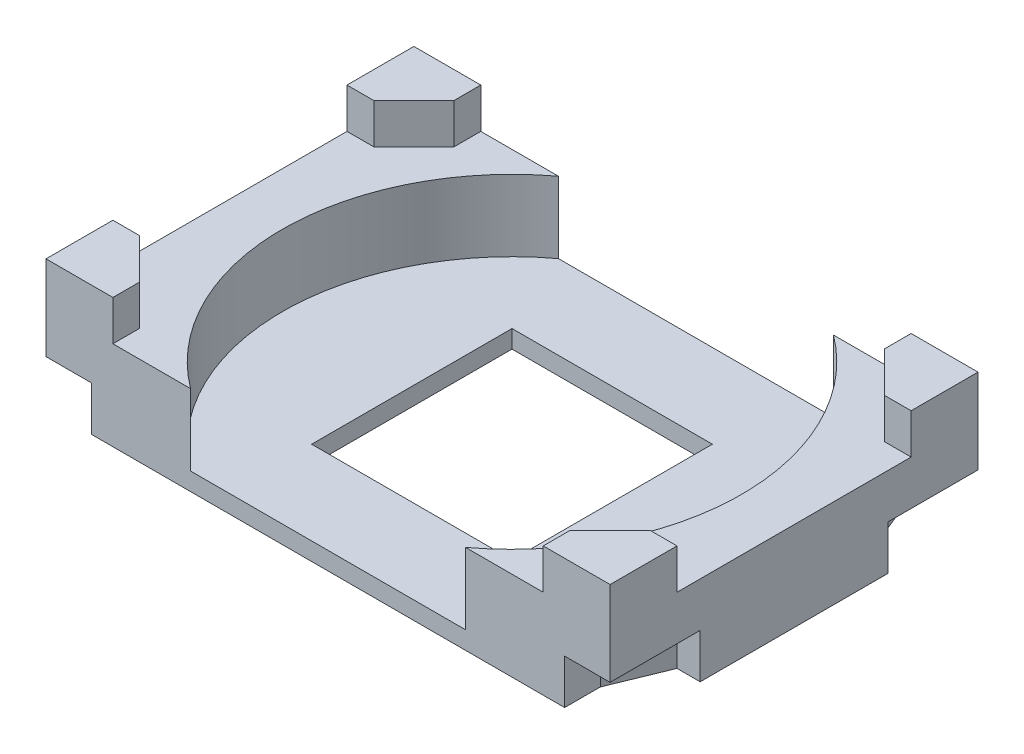
from build123d import *

# Parameters (mm, degrees)
SKETCH_1_W      = 44.92820323
SKETCH_1_H      = 44.928203231
EXTRUDE_1_DEPTH = 4
EXTRUDE_2_DEPTH = 6
EXTRUDE_3_DEPTH = 10
EXTRUDE_4_DEPTH = 9


with BuildPart() as part:
    # Эскиз1 → Бобышка-Вытянуть1 (new body)
    with BuildSketch(Plane(origin=(0, 102.195974268, 0), x_dir=(1, 0, 0), z_dir=(0, 1, 0))):
        Polygon((6.758980694, -68.473129836), (1.558980694, -68.473129836), (1.558980694, -110.573129836), (6.758980694, -110.573129836), (11.758980694, -122.773129836), (11.758980694, -130.773129836), (117.858980694, -130.773129836), (117.858980694, -122.773129836), (122.858980694, -110.573129836), (128.058980694, -110.573129836), (128.058980694, -68.473129836), (122.858980694, -68.473129836), (117.858980694, -56.273129836), (117.858980694, -48.273129836), (11.758980694, -48.273129836), (11.758980694, -56.273129836), align=None)
        with Locations((64.808980694, -89.523129837)):
            Rectangle(SKETCH_1_W, SKETCH_1_H, mode=Mode.SUBTRACT)
    extrude(amount=EXTRUDE_1_DEPTH)

    # Эскиз2 → Бобышка-Вытянуть2 (add)
    with BuildSketch(Plane(origin=(0, 106.195974268, 0), x_dir=(1, 0, 0), z_dir=(0, 1, 0))):
        with BuildLine():
            Line((95.642201414, -130.773129836), (117.858980694, -130.773129836))
            Line((117.858980694, -130.773129836), (117.858980694, -122.773129836))
            Line((117.858980694, -122.773129836), (122.858980694, -110.573129836))
            Line((122.858980694, -110.573129836), (128.058980694, -110.573129836))
            Line((128.058980694, -110.573129836), (128.058980694, -68.473129836))
            Line((128.058980694, -68.473129836), (122.858980694, -68.473129836))
            Line((122.858980694, -68.473129836), (117.858980694, -56.273129836))
            Line((117.858980694, -56.273129836), (117.858980694, -48.273129836))
            Line((117.858980694, -48.273129836), (95.642201414, -48.273129836))
            ThreePointArc((95.642201414, -48.273129836), (116.308980694, -89.523129836), (95.642201414, -130.773129836))
        make_face()
        with BuildLine():
            Line((33.975759973, -48.273129836), (11.758980694, -48.273129836))
            Line((11.758980694, -48.273129836), (11.758980694, -56.273129836))
            Line((11.758980694, -56.273129836), (6.758980694, -68.473129836))
            Line((6.758980694, -68.473129836), (1.558980694, -68.473129836))
            Line((1.558980694, -68.473129836), (1.558980694, -110.573129836))
            Line((1.558980694, -110.573129836), (6.758980694, -110.573129836))
            Line((6.758980694, -110.573129836), (11.758980694, -122.773129836))
            Line((11.758980694, -122.773129836), (11.758980694, -130.773129836))
            Line((11.758980694, -130.773129836), (33.975759973, -130.773129836))
            ThreePointArc((33.975759973, -130.773129836), (13.308980694, -89.523129836), (33.975759973, -48.273129836))
        make_face()
    extrude(amount=EXTRUDE_2_DEPTH)

    # Эскиз3 → Бобышка-Вытянуть3 (add)
    with BuildSketch(Plane(origin=(0, 112.195974268, 0), x_dir=(1, 0, 0), z_dir=(0, 1, 0))):
        with BuildLine():
            Line((1.558980694, -130.773129836), (1.558980694, -48.273129836))
            Line((1.558980694, -48.273129836), (33.975759973, -48.273129836))
            ThreePointArc((33.975759973, -48.273129836), (13.308980694, -89.523129836), (33.975759973, -130.773129836))
            Line((33.975759973, -130.773129836), (1.558980694, -130.773129836))
        make_face()
        with BuildLine():
            Line((95.642201414, -48.273129836), (128.058980694, -48.273129836))
            Line((128.058980694, -48.273129836), (128.058980694, -130.773129836))
            Line((128.058980694, -130.773129836), (95.642201414, -130.773129836))
            ThreePointArc((95.642201414, -130.773129836), (116.308980694, -89.523129836), (95.642201414, -48.273129836))
        make_face()
    extrude(amount=EXTRUDE_3_DEPTH)

    # Эскиз4 → Бобышка-Вытянуть4 (add)
    with BuildSketch(Plane(origin=(0, 122.195974268, 0), x_dir=(1, 0, 0), z_dir=(0, 1, 0))):
        Polygon((1.558980694, -48.273129836), (16.558980694, -48.273129836), (16.558980694, -54.273129836), (7.558980694, -63.273129836), (1.558980694, -63.273129836), align=None)
        Polygon((128.058980694, -48.273129836), (113.058980694, -48.273129836), (113.058980694, -54.273129836), (122.058980694, -63.273129836), (128.058980694, -63.273129836), align=None)
        Polygon((128.058980694, -130.773129836), (128.058980694, -115.773129836), (122.058980694, -115.773129836), (113.058980694, -124.773129836), (113.058980694, -130.773129836), align=None)
        Polygon((1.558980694, -130.773129836), (1.558980694, -115.773129836), (7.558980694, -115.773129836), (16.558980694, -124.773129836), (16.558980694, -130.773129836), align=None)
    extrude(amount=EXTRUDE_4_DEPTH)


solid = part.part
